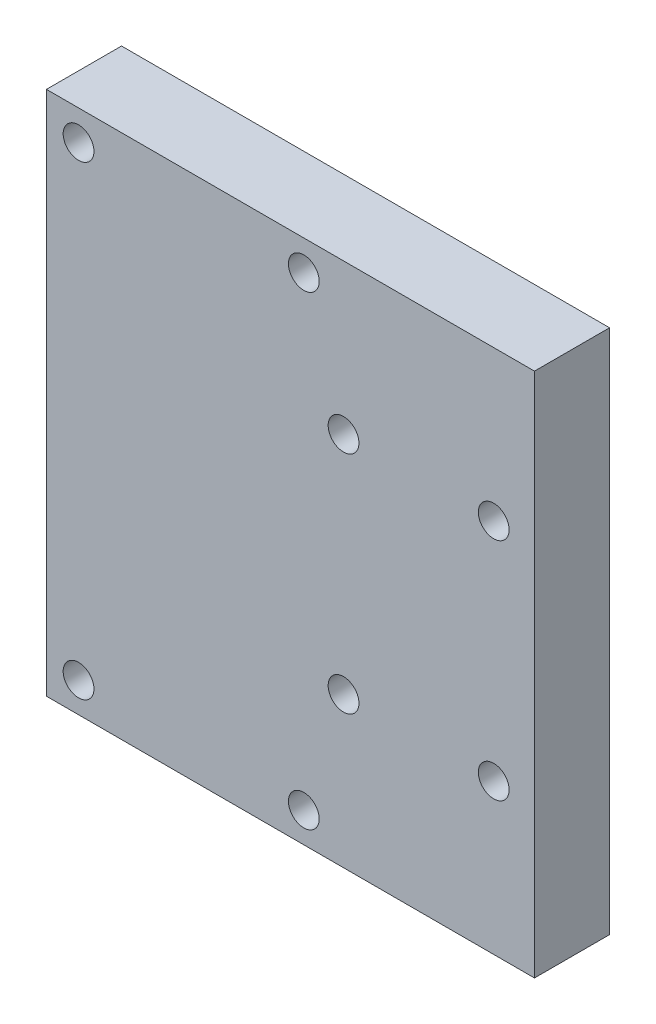
from build123d import *

# Parameters (mm, degrees)
SKETCH1_W           = 65
SKETCH1_H           = 70
SKETCH1_R           = 2.05
BOSS_EXTRUDE1_DEPTH = 10


with BuildPart() as part:
    # Sketch1 → Boss-Extrude1 (new body)
    with BuildSketch(Plane.XY):
        Rectangle(SKETCH1_W, SKETCH1_H)
        with Locations((-28.221560834, 31)):
            Circle(SKETCH1_R, mode=Mode.SUBTRACT)
        with Locations((1.778439166, 31)):
            Circle(SKETCH1_R, mode=Mode.SUBTRACT)
        with Locations((1.778439166, -31)):
            Circle(SKETCH1_R, mode=Mode.SUBTRACT)
        with Locations((-28.221560834, -31)):
            Circle(SKETCH1_R, mode=Mode.SUBTRACT)
        with Locations((27.070034525, 15)):
            Circle(SKETCH1_R, mode=Mode.SUBTRACT)
        with Locations((7.070034525, 15)):
            Circle(SKETCH1_R, mode=Mode.SUBTRACT)
        with Locations((7.070034525, -15)):
            Circle(SKETCH1_R, mode=Mode.SUBTRACT)
        with Locations((27.070034525, -15)):
            Circle(SKETCH1_R, mode=Mode.SUBTRACT)
    extrude(amount=BOSS_EXTRUDE1_DEPTH)


solid = part.part
